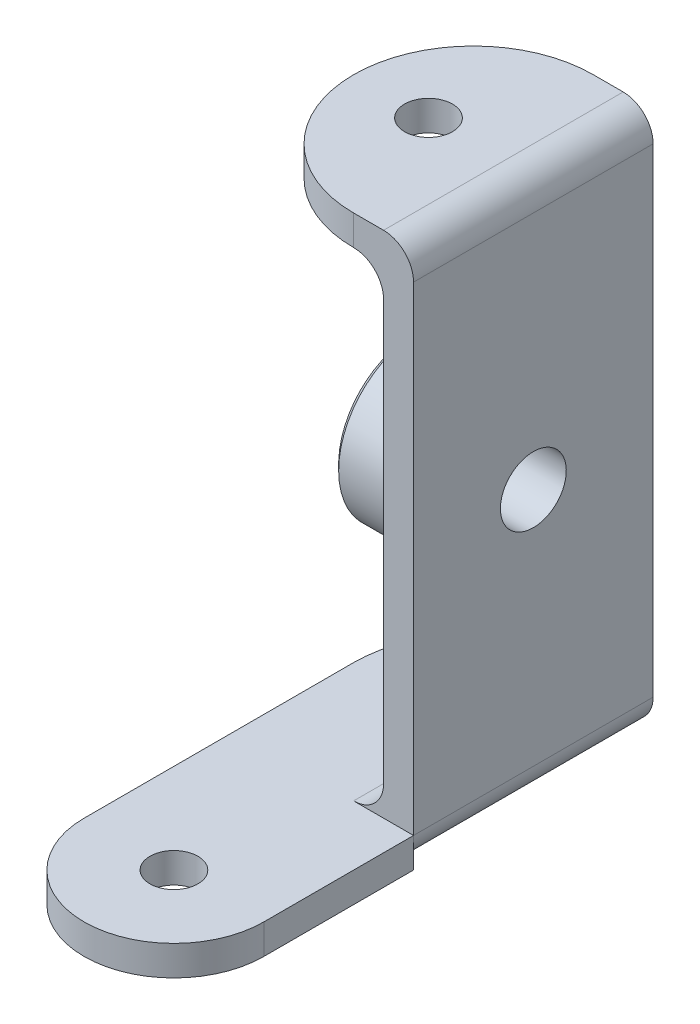
from build123d import *

# Parameters (mm, degrees)
BOSS_EXTRUDE2_DEPTH             = 20
SKETCH2_R                       = 13.5
SKETCH2_R_2                     = 5.5
BOSS_EXTRUDE3_DEPTH             = 15
CUT_EXTRUDE1_DEPTH              = 56.226805086
CUT_EXTRUDE1_DEPTH_BACK         = 56.226805086
SKETCH2_3_R                     = 5.5
CHAMFER1_SIZE                   = 1
SKETCH3_R                       = 4
CUT_EXTRUDE2_DEPTH              = 10
FILLET2_RADIUS                  = 20
FILLET2_LENGTH                  = 5
FILLET3_RADIUS                  = 20
FILLET3_LENGTH                  = 5
SKETCH4_R                       = 4
CUT_EXTRUDE3_DEPTH              = 10
BOSS_EXTRUDE4_DEPTH             = 40
BOSS_EXTRUDE4_DIRECTION_2_REACH = 69.268
SKETCH7_R                       = 4
CUT_EXTRUDE4_DEPTH              = 30
FILLET5_RADIUS                  = 15
FILLET5_LENGTH                  = 5
SKETCH8_R                       = 10
CUT_EXTRUDE5_DEPTH              = 5


with BuildPart() as part:
    # Sketch1 → Boss-Extrude2 (new, symmetric)
    with BuildSketch(Plane.XY):
        with BuildLine():
            Line((0, 45), (25, 45))
            ThreePointArc((25, 45), (28.535533906, 43.535533906), (30, 40))
            Line((30, 40), (30, -40))
            ThreePointArc((30, -40), (28.535533906, -43.535533906), (25, -45))
            Line((25, -45), (0, -45))
            Line((0, -45), (0, -40))
            Line((0, -40), (20, -40))
            ThreePointArc((20, -40), (23.535533906, -38.535533906), (25, -35))
            Line((25, -35), (25, 35))
            ThreePointArc((25, 35), (23.535533906, 38.535533906), (20, 40))
            Line((20, 40), (0, 40))
            Line((0, 40), (0, 45))
        make_face()
    extrude(amount=BOSS_EXTRUDE2_DEPTH, both=True)

    # Sketch2 → Boss-Extrude3 (add)
    # profile 1 of 2: a face of its own
    with BuildSketch(Plane.ZY.offset(-25)):
        with Locations(Location((0, 0, 0), (0, 0, 180))):
            Circle(SKETCH2_R)
        Circle(SKETCH2_R_2, mode=Mode.SUBTRACT)
    # profile 2 of 2: a face of its own
    with BuildSketch(Plane.ZY.offset(-25)):
        Circle(SKETCH2_R_2)
    extrude(amount=BOSS_EXTRUDE3_DEPTH)

    # Sketch2<3> → Cut-Extrude1 (cut, two sides: drawn at the far end of the back side and taken through both)
    with BuildSketch(Plane.ZY.offset(-25).offset(-CUT_EXTRUDE1_DEPTH_BACK)):
        with Locations(Location((0, 0, 0), (0, 0, 270))):
            Circle(SKETCH2_3_R)
    extrude(amount=CUT_EXTRUDE1_DEPTH + CUT_EXTRUDE1_DEPTH_BACK, mode=Mode.SUBTRACT)

    # Chamfer1
    chamfer1_edges = [part.edges().sort_by_distance(p)[0] for p in [
        (10, 0, 13.5),
    ]]
    chamfer(chamfer1_edges, length=CHAMFER1_SIZE)

    # Sketch3 → Cut-Extrude2 (cut)
    with BuildSketch(Plane(origin=(0, 45, 0), x_dir=(1, 0, 0), z_dir=(0, 1, 0))):
        with Locations(Location((12.5, 0, 0), (0, 0, 180))):
            Circle(SKETCH3_R)
    extrude(amount=-CUT_EXTRUDE2_DEPTH, mode=Mode.SUBTRACT)

    # Fillet2: full round fillet: the end face becomes a half cylinder, R = half its width
    fillet2_face = Plane((0, 42.5, 0), x_dir=(0, -1, 0), z_dir=(-1, 0, 0))  # on the end face: x along it, z out of the body
    fillet2_slab = fillet2_face.offset(-FILLET2_RADIUS / 2) * Box(FILLET2_LENGTH, 2 * FILLET2_RADIUS, FILLET2_RADIUS, mode=Mode.PRIVATE)  # the body's end, R deep
    fillet2_round = Plane((20, 42.5, 0), x_dir=(-1, 0, 0), z_dir=(0, -1, 0)) * Cylinder(FILLET2_RADIUS, FILLET2_LENGTH, mode=Mode.PRIVATE)  # its axis R under the face
    add(fillet2_slab - fillet2_round, mode=Mode.SUBTRACT)

    # Fillet3: full round fillet: the end face becomes a half cylinder, R = half its width
    fillet3_face = Plane((0, -42.5, 0), x_dir=(0, -1, 0), z_dir=(-1, 0, 0))  # on the end face: x along it, z out of the body
    fillet3_slab = fillet3_face.offset(-FILLET3_RADIUS / 2) * Box(FILLET3_LENGTH, 2 * FILLET3_RADIUS, FILLET3_RADIUS, mode=Mode.PRIVATE)  # the body's end, R deep
    fillet3_round = Plane((20, -42.5, 0), x_dir=(-1, 0, 0), z_dir=(0, -1, 0)) * Cylinder(FILLET3_RADIUS, FILLET3_LENGTH, mode=Mode.PRIVATE)  # its axis R under the face
    add(fillet3_slab - fillet3_round, mode=Mode.SUBTRACT)

    # Sketch4 → Cut-Extrude3 (cut)
    with BuildSketch(Plane(origin=(0, -40, 0), x_dir=(1, 0, 0), z_dir=(0, 1, 0))):
        with Locations(Location((12.5, 0, 0), (0, 0, 180))):
            Circle(SKETCH4_R)
    extrude(amount=-CUT_EXTRUDE3_DEPTH, mode=Mode.SUBTRACT)

    # Sketch6 → Boss-Extrude4 (add)
    with BuildSketch(Plane.XY.offset(20)):
        Polygon((0, -40), (0, -45), (30, -45), (30, -40), (20, -40), align=None)
    extrude(amount=BOSS_EXTRUDE4_DEPTH)

    # Sketch6 → Boss-Extrude4 direction 2 (add, up to next)
    with BuildSketch(Plane.XY.offset(20), mode=Mode.PRIVATE) as boss_extrude4_direction_2_sk1:
        Polygon((0, -40), (0, -45), (30, -45), (30, -40), (20, -40), align=None)
    boss_extrude4_direction_2_tool1 = extrude(boss_extrude4_direction_2_sk1.sketch, amount=-BOSS_EXTRUDE4_DIRECTION_2_REACH, mode=Mode.PRIVATE) - part.part
    add(boss_extrude4_direction_2_tool1.solids().sort_by_distance((15, -42.5, 20))[0])

    # Sketch7 → Cut-Extrude4 (cut)
    with BuildSketch(Plane(origin=(0, -40, 0), x_dir=(1, 0, 0), z_dir=(0, 1, 0))):
        with Locations(Location((15, -45, 0), (0, 0, 180))):
            Circle(SKETCH7_R)
    extrude(amount=-CUT_EXTRUDE4_DEPTH, mode=Mode.SUBTRACT)

    # Fillet5: full round fillet: the end face becomes a half cylinder, R = half its width
    fillet5_face = Plane((15, -42.5, 60), x_dir=(0, -1, 0), z_dir=(0, 0, 1))  # on the end face: x along it, z out of the body
    fillet5_slab = fillet5_face.offset(-FILLET5_RADIUS / 2) * Box(FILLET5_LENGTH, 2 * FILLET5_RADIUS, FILLET5_RADIUS, mode=Mode.PRIVATE)  # the body's end, R deep
    fillet5_round = Plane((15, -42.5, 45), x_dir=(0, 0, 1), z_dir=(0, -1, 0)) * Cylinder(FILLET5_RADIUS, FILLET5_LENGTH, mode=Mode.PRIVATE)  # its axis R under the face
    add(fillet5_slab - fillet5_round, mode=Mode.SUBTRACT)

    # Sketch8 → Cut-Extrude5 (cut)
    with BuildSketch(Plane.ZY.offset(-10)):
        with Locations(Location((0, 0, 0), (0, 0, 270))):
            Circle(SKETCH8_R)
    extrude(amount=-CUT_EXTRUDE5_DEPTH, mode=Mode.SUBTRACT)


solid = part.part
